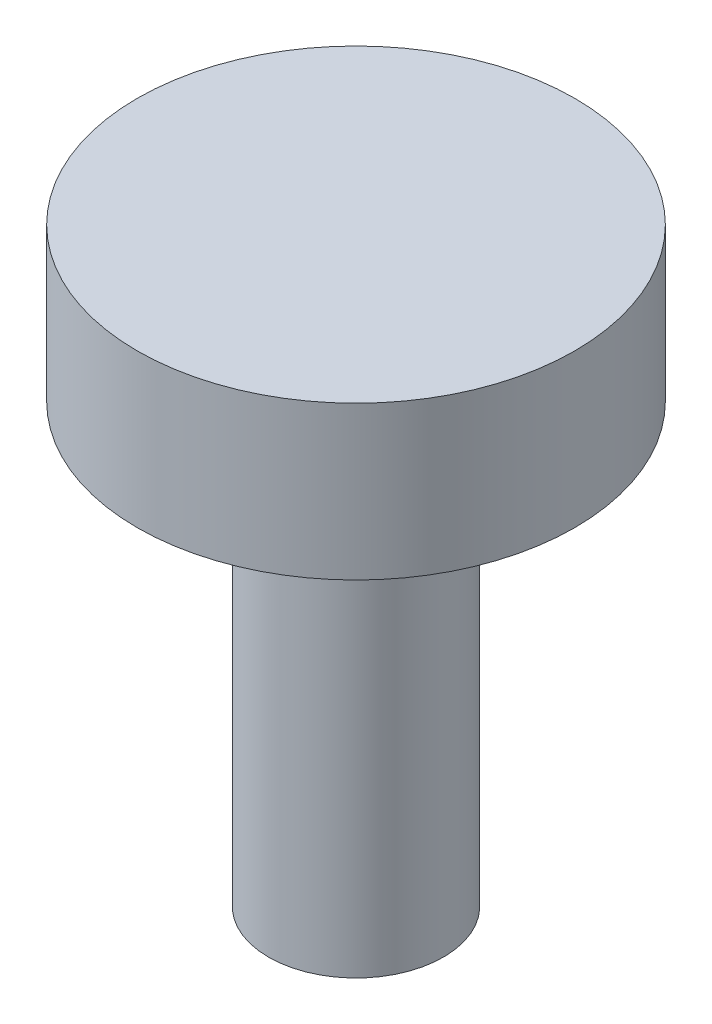
from build123d import *

# Parameters (mm, degrees)
SKETCH1_R           = 10
BOSS_EXTRUDE1_DEPTH = 7
SKETCH1_3_R         = 4
BOSS_EXTRUDE2_DEPTH = 20


with BuildPart() as part:
    # Sketch1 → Boss-Extrude1 (new body)
    with BuildSketch(Plane(origin=(0, 0, 0), x_dir=(1, 0, 0), z_dir=(0, 1, 0))):
        Circle(SKETCH1_R)
    extrude(amount=BOSS_EXTRUDE1_DEPTH)

    # Sketch1<3> → Boss-Extrude2 (add)
    with BuildSketch(Plane(origin=(0, 0, 0), x_dir=(1, 0, 0), z_dir=(0, 1, 0))):
        Circle(SKETCH1_3_R)
    extrude(amount=-BOSS_EXTRUDE2_DEPTH)


solid = part.part
